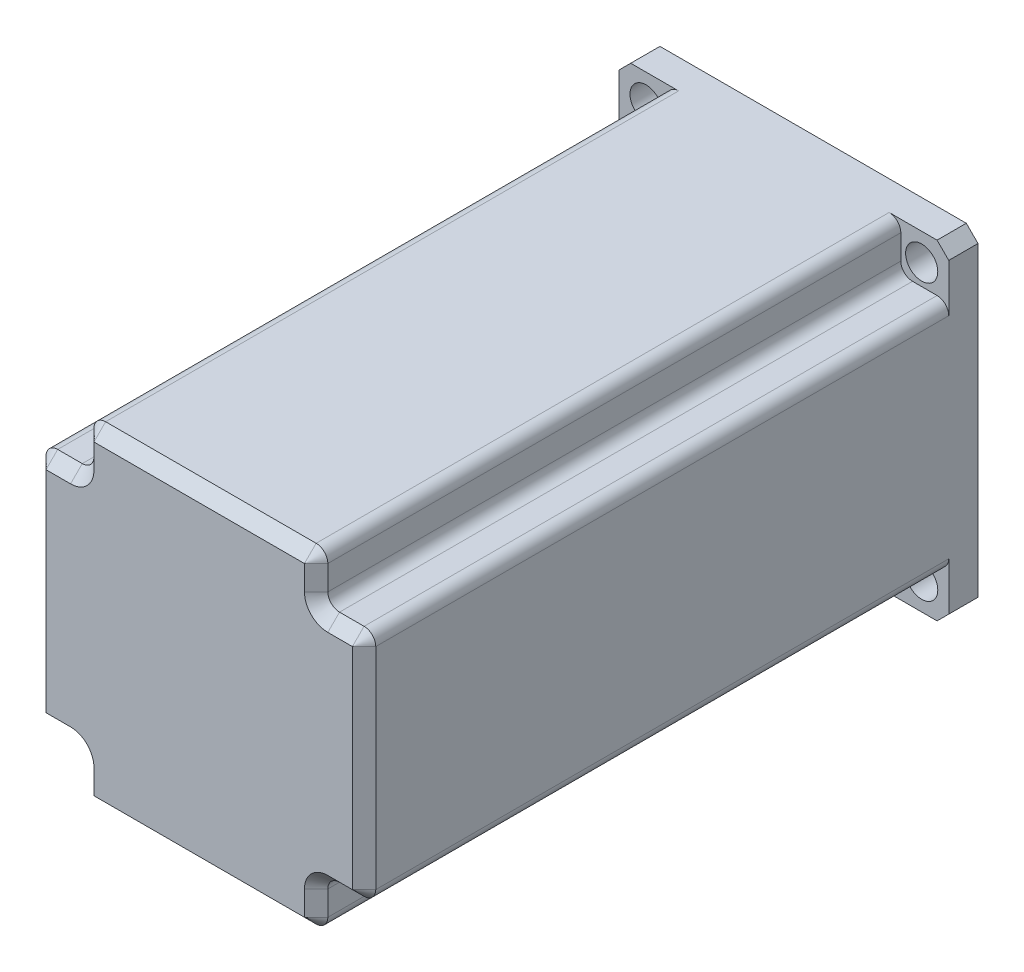
from build123d import *

# Parameters (mm, degrees)
SZKIC1_W                    = 56.4
SZKIC1_H                    = 56.4
DODANIE_WYCI_GNI_CIE1_DEPTH = 105
SZKIC2_R                    = 4
DODANIE_WYCI_GNI_CIE2_DEPTH = 20
SZKIC3_W                    = 8.2
SZKIC3_H                    = 8.2
WYTNIJ_WYCI_GNI_CIE1_DEPTH  = 100
ZAOKR_GLENIE1_R             = 2
SFAZOWANIE1_SIZE            = 2
OTW_R_POD_RUB_M51_D         = 5.5
OTW_R_POD_RUB_M51_DEPTH     = 11
OTW_R_POD_RUB_M51_TIP       = 1.652366702
SFAZOWANIE2_SIZE            = 1


with BuildPart() as part:
    # Szkic1 → Dodanie-wyciągnięcie1 (new body)
    with BuildSketch(Plane.XY):
        Rectangle(SZKIC1_W, SZKIC1_H)
    extrude(amount=DODANIE_WYCI_GNI_CIE1_DEPTH)

    # Szkic2 → Dodanie-wyciągnięcie2 (add)
    with BuildSketch(Plane(origin=(0, 0, 0), x_dir=(-1, 0, 0), z_dir=(0, 0, -1))):
        with Locations(Location((0, 0, 0), (0, 0, 180))):
            Circle(SZKIC2_R)
    extrude(amount=DODANIE_WYCI_GNI_CIE2_DEPTH)

    # Szkic3 → Wytnij-wyciągnięcie1 (cut)
    with BuildSketch(Plane.XY.offset(105)):
        with Locations((-24.1, 24.1)):
            Rectangle(SZKIC3_W, SZKIC3_H)
        with Locations((24.1, 24.1)):
            Rectangle(SZKIC3_W, SZKIC3_H)
        with Locations((24.1, -24.1)):
            Rectangle(SZKIC3_W, SZKIC3_H)
        with Locations((-24.1, -24.1)):
            Rectangle(SZKIC3_W, SZKIC3_H)
    extrude(amount=-WYTNIJ_WYCI_GNI_CIE1_DEPTH, mode=Mode.SUBTRACT)

    # Zaokrąglenie1
    zaokr_glenie1_edges = [part.edges().sort_by_distance(p)[0] for p in [
        (-20, -28.2, 55),
        (-28.2, -20, 55),
        (-20, -20, 55),
        (28.2, -20, 55),
        (20, -28.2, 55),
        (20, -20, 55),
        (20, 28.2, 55),
        (28.2, 20, 55),
        (20, 20, 55),
        (-28.2, 20, 55),
        (-20, 28.2, 55),
        (-20, 20, 55),
    ]]
    fillet(zaokr_glenie1_edges, radius=ZAOKR_GLENIE1_R)

    # Sfazowanie1
    sfazowanie1_edges = [part.edges().sort_by_distance(p)[0] for p in [
        (-20.585786438, -20.585786438, 105),
        (20.585786438, -20.585786438, 105),
        (20.585786438, 20.585786438, 105),
        (-20.585786438, 20.585786438, 105),
        (28.2, -28.2, 2.5),
        (-28.2, -28.2, 2.5),
        (-28.2, 28.2, 2.5),
        (28.2, 28.2, 2.5),
        (-20, -24.1, 105),
        (0, -28.2, 105),
        (20, -24.1, 105),
        (24.1, -20, 105),
        (28.2, 0, 105),
        (24.1, 20, 105),
        (20, 24.1, 105),
        (0, 28.2, 105),
        (-20, 24.1, 105),
        (-24.1, 20, 105),
        (-28.2, 0, 105),
        (-24.1, -20, 105),
        (-27.614213562, 19.414213562, 105),
        (-19.414213562, 27.614213562, 105),
        (19.414213562, 27.614213562, 105),
        (27.614213562, 19.414213562, 105),
        (27.614213562, -19.414213562, 105),
        (19.414213562, -27.614213562, 105),
        (-27.614213562, -19.414213562, 105),
        (-19.414213562, -27.614213562, 105),
    ]]
    chamfer(sfazowanie1_edges, length=SFAZOWANIE1_SIZE)

    # Otwór pod śrubę M51
    with Locations(Plane(origin=(0, 0, 0), x_dir=(-1, 0, 0), z_dir=(0, 0, -1))):
        with Locations((-23.57, 23.57), (23.57, 23.57), (23.57, -23.57), (-23.57, -23.57)):
            Hole(OTW_R_POD_RUB_M51_D / 2, depth=OTW_R_POD_RUB_M51_DEPTH)
            with Locations((0, 0, -(OTW_R_POD_RUB_M51_DEPTH + OTW_R_POD_RUB_M51_TIP / 2))):  # 118° drill point
                Cone(0, OTW_R_POD_RUB_M51_D / 2, OTW_R_POD_RUB_M51_TIP, mode=Mode.SUBTRACT)

    # Sfazowanie2
    sfazowanie2_edges = [part.edges().sort_by_distance(p)[0] for p in [
        (-4, 0, -20),
    ]]
    chamfer(sfazowanie2_edges, length=SFAZOWANIE2_SIZE)


solid = part.part
